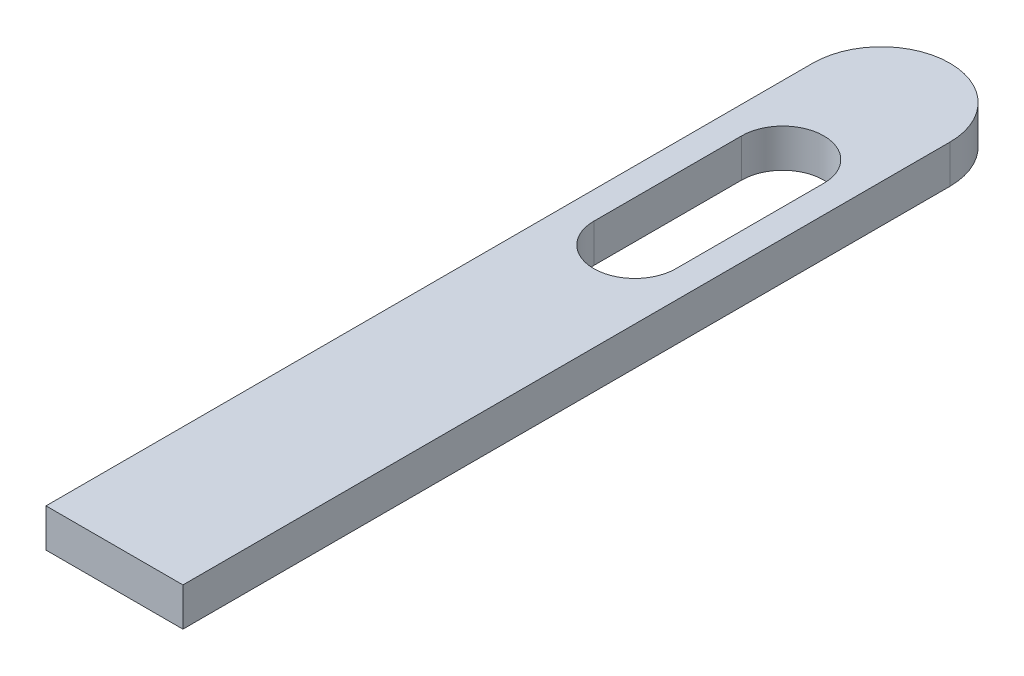
from build123d import *

# Parameters (mm, degrees)
BOSS_EXTRUDE2_DEPTH = 0.175


with BuildPart() as part:
    # Sketch1 → Boss-Extrude2 (new, symmetric)
    with BuildSketch(Plane(origin=(0, 0, 0), x_dir=(1, 0, 0), z_dir=(0, 1, 0))):
        with BuildLine():
            Line((-0.625, 3.5), (-0.625, -3.5))
            Line((-0.625, -3.5), (0.625, -3.5))
            Line((0.625, -3.5), (0.625, 3.5))
            ThreePointArc((0.625, 3.5), (0, 4.125), (-0.625, 3.5))
        make_face()
        with BuildLine():
            Line((0.375, 2.6), (0.375, 1.25))
            ThreePointArc((0.375, 1.25), (0, 0.875), (-0.375, 1.25))
            Line((-0.375, 1.25), (-0.375, 2.6))
            ThreePointArc((-0.375, 2.6), (0, 2.975), (0.375, 2.6))
        make_face(mode=Mode.SUBTRACT)
    extrude(amount=BOSS_EXTRUDE2_DEPTH, both=True)


solid = part.part
